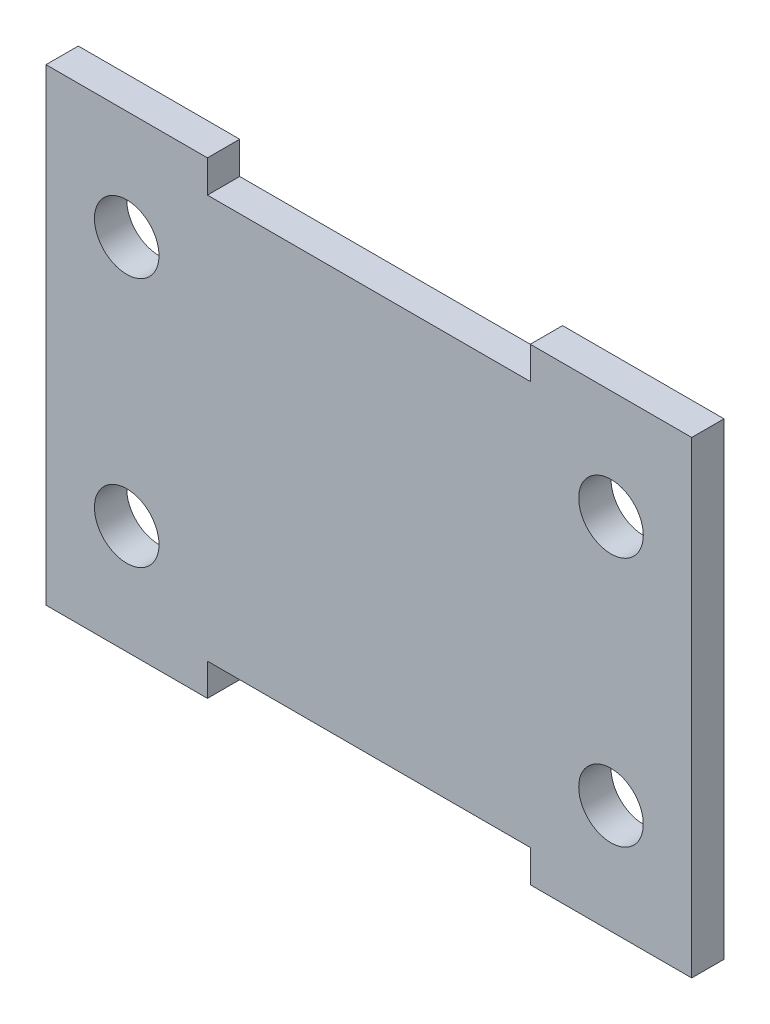
from build123d import *

# Parameters (mm, degrees)
SKETCH1_R           = 4
BOSS_EXTRUDE1_DEPTH = 4


with BuildPart() as part:
    # Sketch1 → Boss-Extrude1 (new body)
    with BuildSketch(Plane.XY):
        Polygon((-20, 25), (20, 25), (20, 29), (40, 29), (40, 25), (40, -25), (40, -29), (20, -29), (20, -25), (-20, -25), (-20, -29), (-40, -29), (-40, -25), (-40, 25), (-40, 29), (-20, 29), align=None)
        with Locations((30, 15.5)):
            Circle(SKETCH1_R, mode=Mode.SUBTRACT)
        with Locations(Location((-30, 15.5, 0), (0, 0, 180))):
            Circle(SKETCH1_R, mode=Mode.SUBTRACT)
        with Locations((-30, -15.5)):
            Circle(SKETCH1_R, mode=Mode.SUBTRACT)
        with Locations(Location((30, -15.5, 0), (0, 0, 180))):
            Circle(SKETCH1_R, mode=Mode.SUBTRACT)
    extrude(amount=BOSS_EXTRUDE1_DEPTH)


solid = part.part
